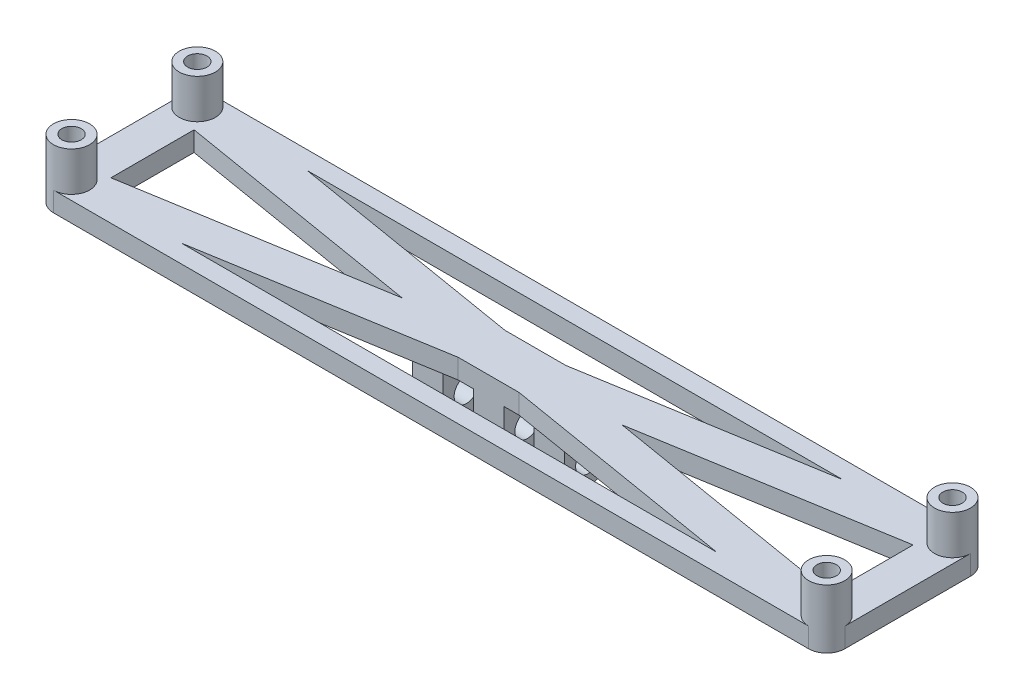
from build123d import *

# Parameters (mm, degrees)
BOSS_EXTRUDE2_DEPTH = 2
SKETCH4_R           = 1.835
BOSS_EXTRUDE3_DEPTH = 4
SKETCH6_R           = 0.985
CUT_EXTRUDE1_DEPTH  = 4
SKETCH7_R           = 1.25
BOSS_EXTRUDE4_DEPTH = 3.086
SKETCH8_R           = 1.25
BOSS_EXTRUDE5_DEPTH = 1.543
BOSS_EXTRUDE6_START = 3.086
SKETCH9_R           = 1.25
BOSS_EXTRUDE6_DEPTH = 3.086


with BuildPart() as part:
    # Sketch3 → Boss-Extrude2 (new body)
    with BuildSketch(Plane(origin=(0, 0, 0), x_dir=(1, 0, 0), z_dir=(0, 1, 0))):
        with BuildLine():
            Line((38.36, -8.225), (-38.36, -8.225))
            ThreePointArc((-38.36, -8.225), (-39.657541, -7.687541), (-40.195, -6.39))
            Line((-40.195, -6.39), (-40.195, 6.39))
            ThreePointArc((-40.195, 6.39), (-39.657541, 7.687541), (-38.36, 8.225))
            Line((-38.36, 8.225), (38.36, 8.225))
            ThreePointArc((38.36, 8.225), (39.657541, 7.687541), (40.195, 6.39))
            Line((40.195, 6.39), (40.195, -6.39))
            ThreePointArc((40.195, -6.39), (39.657541, -7.687541), (38.36, -8.225))
        make_face()
        Polygon((-3.089899, 2.375), (3.089899, 2.375), (27.192466, 6.39), (-27.192466, 6.39), align=None, mode=Mode.SUBTRACT)
        Polygon((3.089899, -2.375), (27.192466, -6.39), (-27.192466, -6.39), (-3.089899, -2.375), align=None, mode=Mode.SUBTRACT)
        Polygon((-36.525, 4.224041), (-36.525, -4.224041), (-11.167534, 0), align=None, mode=Mode.SUBTRACT)
        Polygon((36.525, -4.224041), (11.167534, 0), (36.525, 4.224041), align=None, mode=Mode.SUBTRACT)
    extrude(amount=BOSS_EXTRUDE2_DEPTH)

    # Sketch4 → Boss-Extrude3 (add)
    with BuildSketch(Plane(origin=(0, 2, 0), x_dir=(1, 0, 0), z_dir=(0, 1, 0))):
        with Locations(Location((-38.36, 6.39, 0), (0, 0, 90))):
            Circle(SKETCH4_R)
        with Locations(Location((-38.36, -6.39, 0), (0, 0, 270))):
            Circle(SKETCH4_R)
        with Locations(Location((38.36, 6.39, 0), (0, 0, 90))):
            Circle(SKETCH4_R)
        with Locations(Location((38.36, -6.39, 0), (0, 0, 270))):
            Circle(SKETCH4_R)
    extrude(amount=BOSS_EXTRUDE3_DEPTH)

    # Sketch6 → Cut-Extrude1 (cut)
    with BuildSketch(Plane(origin=(0, 6, 0), x_dir=(1, 0, 0), z_dir=(0, 1, 0))):
        with Locations(Location((-38.36, 6.39, 0), (0, 0, 270))):
            Circle(SKETCH6_R)
        with Locations(Location((-38.36, -6.39, 0), (0, 0, 270))):
            Circle(SKETCH6_R)
        with Locations(Location((38.36, 6.39, 0), (0, 0, 270))):
            Circle(SKETCH6_R)
        with Locations(Location((38.36, -6.39, 0), (0, 0, 270))):
            Circle(SKETCH6_R)
    extrude(amount=-CUT_EXTRUDE1_DEPTH, mode=Mode.SUBTRACT)

    # Sketch7 → Boss-Extrude4 (add)
    with BuildSketch(Plane.ZY.offset(-7.715)):
        with BuildLine():
            Line((2.375, -2.775), (2.375, 0))
            Line((2.375, 0), (-2.375, 0))
            Line((-2.375, 0), (-2.375, -2.775))
            ThreePointArc((-2.375, -2.775), (0, -5.15), (2.375, -2.775))
        make_face()
        with Locations((0, -2.775)):
            Circle(SKETCH7_R, mode=Mode.SUBTRACT)
    extrude(amount=BOSS_EXTRUDE4_DEPTH)

    # Sketch8 → Boss-Extrude5 (add, symmetric)
    with BuildSketch(Plane.ZY):
        with BuildLine():
            Line((2.375, 0), (-2.375, 0))
            Line((-2.375, 0), (-2.375, -2.775))
            ThreePointArc((-2.375, -2.775), (0, -5.15), (2.375, -2.775))
            Line((2.375, -2.775), (2.375, 0))
        make_face()
        with Locations((0, -2.775)):
            Circle(SKETCH8_R, mode=Mode.SUBTRACT)
    extrude(amount=BOSS_EXTRUDE5_DEPTH, both=True)

    # Sketch9 → Boss-Extrude6 (add)
    with BuildSketch(Plane(origin=(-7.715, 0, 0), x_dir=(0, 0, 1), z_dir=(1, 0, 0)).offset(BOSS_EXTRUDE6_START)):
        with BuildLine():
            Line((-2.375, 0), (2.375, 0))
            Line((2.375, 0), (2.375, 2.775))
            ThreePointArc((2.375, 2.775), (0, 5.15), (-2.375, 2.775))
            Line((-2.375, 2.775), (-2.375, 0))
        make_face()
        with Locations((0, 2.775)):
            Circle(SKETCH9_R, mode=Mode.SUBTRACT)
    extrude(amount=-BOSS_EXTRUDE6_DEPTH)


solid = part.part
